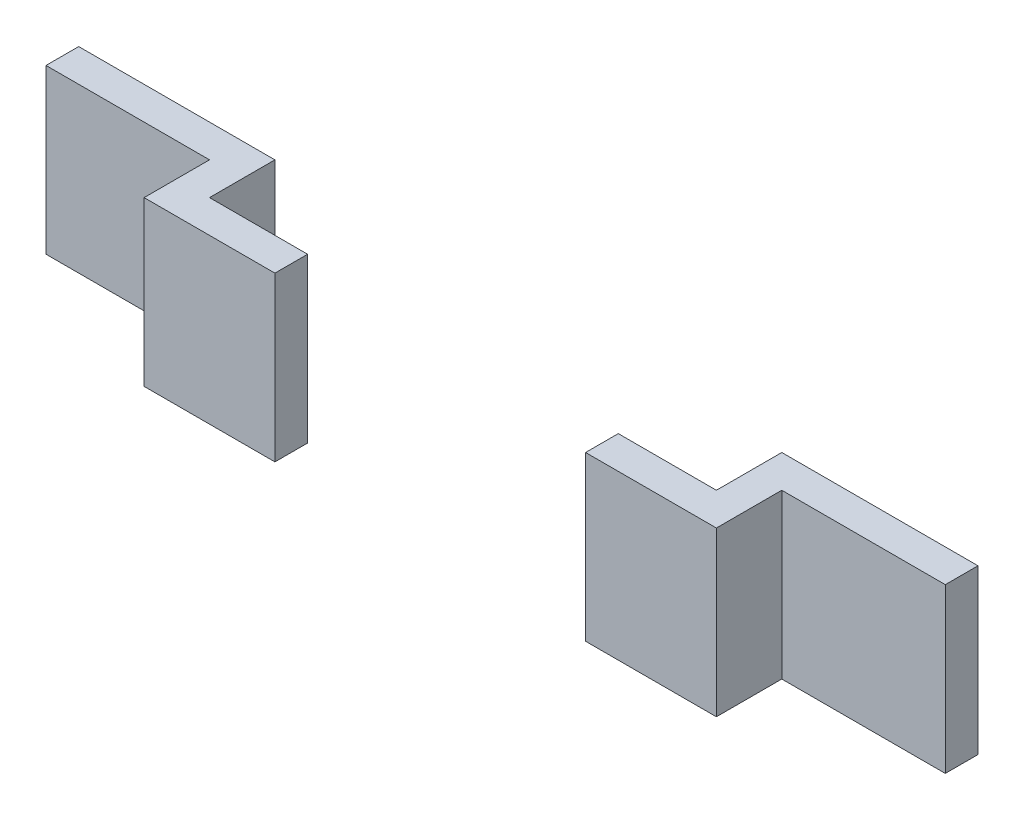
from build123d import *

# Parameters (mm, degrees)
SKETCH1_W             = 5
SKETCH1_H             = 5
BOSS_EXTRUDE1_DEPTH   = 1
BOSS_EXTRUDE1_2_DEPTH = 1
SKETCH2_W             = 1
SKETCH2_H             = 5
BOSS_EXTRUDE2_DEPTH   = 3
SKETCH3_W             = 3
SKETCH3_H             = 5
SKETCH3_W_2           = 4
BOSS_EXTRUDE3_DEPTH   = 1


with BuildPart() as part:
    # Sketch1 → Boss-Extrude1 (new body)
    with BuildSketch(Plane.XY):
        with Locations((-11.25, 0)):
            Rectangle(SKETCH1_W, SKETCH1_H)
    extrude(amount=BOSS_EXTRUDE1_DEPTH)



with BuildPart() as body_2:
    # Sketch1 → Boss-Extrude1 2 (new body)
    with BuildSketch(Plane.XY):
        with Locations((11.25, 0)):
            Rectangle(SKETCH1_W, SKETCH1_H)
    extrude(amount=BOSS_EXTRUDE1_2_DEPTH)


with BuildPart() as part_1:
    add(part.part)

    add(body_2.part)  # Boss-Extrude2 merges body 2
    # Sketch2 → Boss-Extrude2 (add)
    with BuildSketch(Plane.XY):
        with Locations((-8.25, 0)):
            Rectangle(SKETCH2_W, SKETCH2_H)
        with Locations((8.25, 0)):
            Rectangle(SKETCH2_W, SKETCH2_H)
    extrude(amount=BOSS_EXTRUDE2_DEPTH)

    # Sketch3 → Boss-Extrude3 (add)
    with BuildSketch(Plane.XY.offset(3)):
        with Locations((-6.25, 0)):
            Rectangle(SKETCH3_W, SKETCH3_H)
        with Locations((6.75, 0)):
            Rectangle(SKETCH3_W_2, SKETCH3_H)
    extrude(amount=-BOSS_EXTRUDE3_DEPTH)


solid = part_1.part
